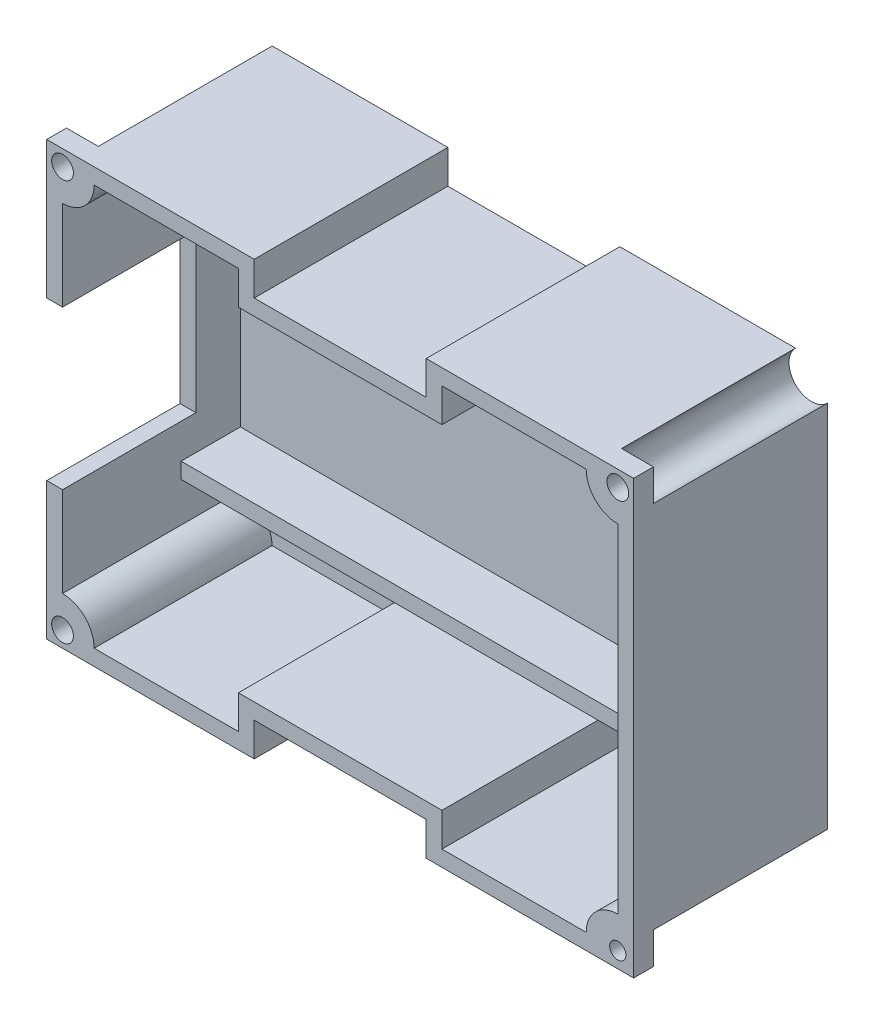
from build123d import *

# Parameters (mm, degrees)
BOSS_EXTRUDE1_DEPTH = 1.6
SKETCH2_R           = 1.1
SKETCH2_R_2         = 0.822376014
BOSS_EXTRUDE2_DEPTH = 18
CUT_EXTRUDE1_START  = -2
SKETCH4_R           = 2.275
CUT_EXTRUDE1_DEPTH  = 18
SKETCH5_W           = 13.5
SKETCH5_H           = 16
CUT_EXTRUDE2_DEPTH  = 18
SKETCH6_W           = 44.533379649
SKETCH6_H           = 1.6
BOSS_EXTRUDE3_DEPTH = 6


with BuildPart() as part:
    # Sketch1 → Boss-Extrude1 (new body)
    with BuildSketch(Plane.XY):
        Polygon((-38.4, 43.8), (-38.4, 40.4), (-21, 40.4), (-21, 43.8), (0, 43.8), (0, 0), (-21, 0), (-21, 3.4), (-38.4, 3.4), (-38.4, 0), (-59.4, 0), (-59.4, 43.8), align=None)
    extrude(amount=BOSS_EXTRUDE1_DEPTH)

    # Sketch2 → Boss-Extrude2 (add)
    with BuildSketch(Plane.XY.offset(1.6)):
        Polygon((-59.4, 43.8), (-38.4, 43.8), (-38.4, 40.4), (-21, 40.4), (-21, 43.8), (0, 43.8), (0, 0), (-21, 0), (-21, 3.4), (-38.4, 3.4), (-38.4, 0), (-59.4, 0), align=None)
        with Locations((-57.8, 1.6)):
            Circle(SKETCH2_R, mode=Mode.SUBTRACT)
        with Locations((-57.8, 42.2)):
            Circle(SKETCH2_R, mode=Mode.SUBTRACT)
        with Locations((-1.6, 42.2)):
            Circle(SKETCH2_R, mode=Mode.SUBTRACT)
        with Locations((-1.6, 1.6)):
            Circle(SKETCH2_R_2, mode=Mode.SUBTRACT)
        with BuildLine():
            Line((-54.6, 42.2), (-40, 42.2))
            Line((-40, 42.2), (-40, 38.8))
            Line((-40, 38.8), (-19.4, 38.8))
            Line((-19.4, 38.8), (-19.4, 42.2))
            Line((-19.4, 42.2), (-4.8, 42.2))
            ThreePointArc((-4.8, 42.2), (-3.8627417, 39.9372583), (-1.6, 39))
            Line((-1.6, 39), (-1.6, 4.8))
            ThreePointArc((-1.6, 4.8), (-3.8627417, 3.8627417), (-4.8, 1.6))
            Line((-4.8, 1.6), (-19.4, 1.6))
            Line((-19.4, 1.6), (-19.4, 5))
            Line((-19.4, 5), (-40, 5))
            Line((-40, 5), (-40, 1.6))
            Line((-40, 1.6), (-54.6, 1.6))
            ThreePointArc((-54.6, 1.6), (-55.5372583, 3.8627417), (-57.8, 4.8))
            Line((-57.8, 4.8), (-57.8, 39))
            ThreePointArc((-57.8, 39), (-55.5372583, 39.9372583), (-54.6, 42.2))
        make_face(mode=Mode.SUBTRACT)
    extrude(amount=BOSS_EXTRUDE2_DEPTH)

    # Sketch4 → Cut-Extrude1 (cut)
    with BuildSketch(Plane.XY.offset(19.6).offset(CUT_EXTRUDE1_START)):
        with Locations((-57.8, 42.2)):
            Circle(SKETCH4_R)
        with Locations((-1.6, 42.2)):
            Circle(SKETCH4_R)
        with Locations((-57.8, 1.6)):
            Circle(SKETCH4_R)
        with Locations((-1.6, 1.6)):
            Circle(SKETCH4_R)
    extrude(amount=-CUT_EXTRUDE1_DEPTH, mode=Mode.SUBTRACT)

    # Sketch5 → Cut-Extrude2 (cut)
    with BuildSketch(Plane.ZY.offset(59.4)):
        with Locations((12.85, 21.9)):
            Rectangle(SKETCH5_W, SKETCH5_H)
    extrude(amount=-CUT_EXTRUDE2_DEPTH, mode=Mode.SUBTRACT)

    # Sketch6 → Boss-Extrude3 (add)
    with BuildSketch(Plane.XY.offset(1.6)):
        Polygon((-57.8, 33.4), (-3.8, 33.4), (-3.8, 10.4), (-3.8, 8.8), (-1.6, 8.8), (-1.6, 35), (-57.8, 35), align=None)
        with Locations((-35.533310176, 9.6)):
            Rectangle(SKETCH6_W, SKETCH6_H)
    extrude(amount=BOSS_EXTRUDE3_DEPTH)


solid = part.part
